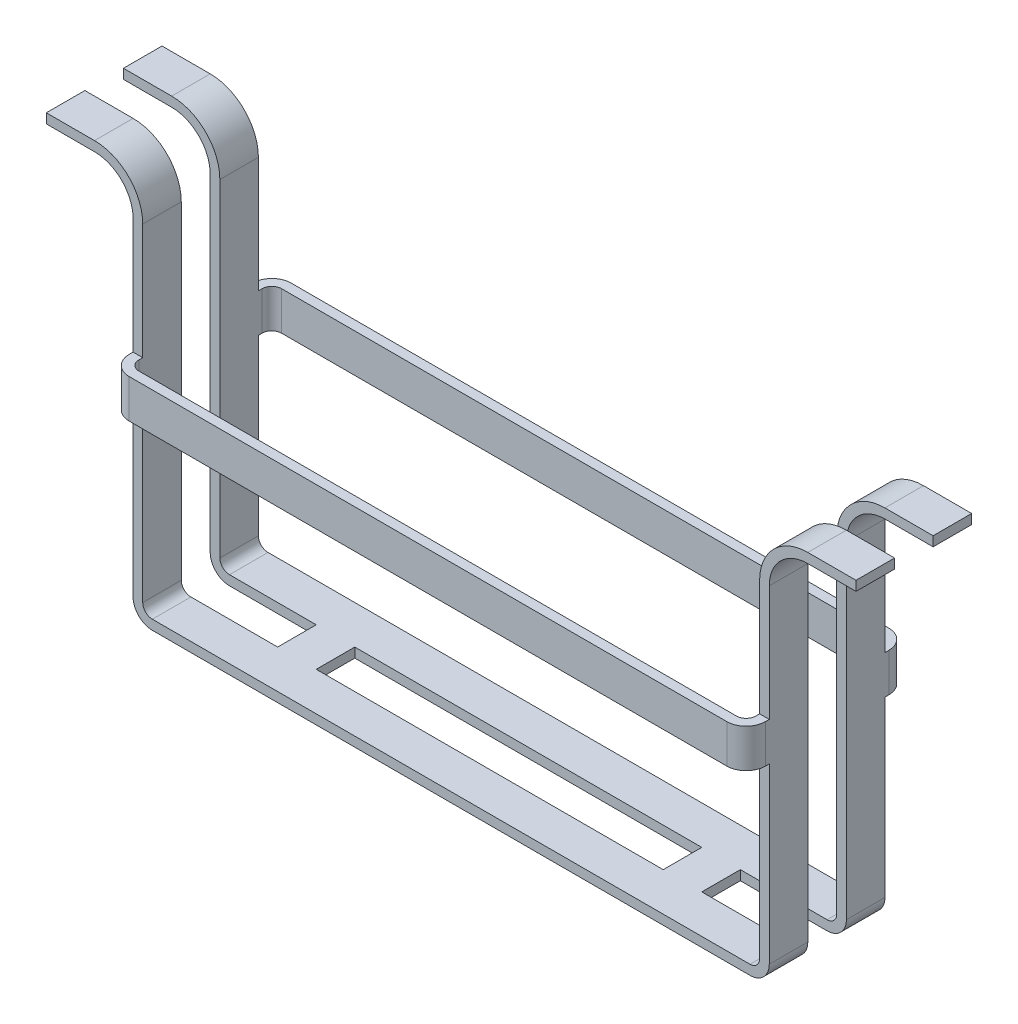
from build123d import *

# Parameters (mm, degrees)
EXTRUDE_1_DEPTH   = 20
EXTRUDE_2_DEPTH   = 20
SKETCH_3_W        = 20
SKETCH_3_H        = 20
EXTRUDE_1_2_DEPTH = 5


with BuildPart() as part:
    # 草图1 → Extrude 1 (new body)
    with BuildSketch(Plane.XY):
        with BuildLine():
            Line((210, 200), (185, 200))
            ThreePointArc((185, 200), (170.857864376, 194.142135624), (165, 180))
            Line((165, 180), (165, 10))
            ThreePointArc((165, 10), (162.071067812, 2.928932188), (155, 0))
            Line((155, 0), (-155, 0))
            ThreePointArc((-155, 0), (-162.071067812, 2.928932188), (-165, 10))
            Line((-165, 10), (-165, 180))
            ThreePointArc((-165, 180), (-170.857864376, 194.142135624), (-185, 200))
            Line((-185, 200), (-210, 200))
            Line((-210, 200), (-210, 205))
            Line((-210, 205), (-185, 205))
            ThreePointArc((-185, 205), (-167.32233047, 197.67766953), (-160, 180))
            Line((-160, 180), (-160, 10))
            ThreePointArc((-160, 10), (-158.535533906, 6.464466094), (-155, 5))
            Line((-155, 5), (155, 5))
            ThreePointArc((155, 5), (158.535533906, 6.464466094), (160, 10))
            Line((160, 10), (160, 180))
            ThreePointArc((160, 180), (167.32233047, 197.67766953), (185, 205))
            Line((185, 205), (210, 205))
            Line((210, 205), (210, 200))
        make_face()
    extrude(amount=EXTRUDE_1_DEPTH)

    # 草图2 → 拉伸-薄壁2 (add)
    with BuildSketch(Plane(origin=(0, 100, 0), x_dir=(1, 0, 0), z_dir=(0, 1, 0))):
        with BuildLine():
            Line((-165, -20), (-165, -22))
            ThreePointArc((-165, -22), (-162.071067812, -29.071067812), (-155, -32))
            Line((-155, -32), (155, -32))
            ThreePointArc((155, -32), (162.071067812, -29.071067812), (165, -22))
            Line((165, -22), (165, -20))
            Line((165, -20), (160, -20))
            Line((160, -20), (160, -22))
            ThreePointArc((160, -22), (158.535533906, -25.535533906), (155, -27))
            Line((155, -27), (-155, -27))
            ThreePointArc((-155, -27), (-158.535533906, -25.535533906), (-160, -22))
            Line((-160, -22), (-160, -20))
            Line((-160, -20), (-165, -20))
        make_face()
    extrude(amount=EXTRUDE_2_DEPTH)


with BuildPart() as body_2:
    # 镜向3: mirrored copy
    add(part.part.mirror(Plane.XY.offset(-10)))


with BuildPart() as part_1:
    add(part.part)

    add(body_2.part)  # Extrude 1 2 merges body 2
    # 草图3 → Extrude 1 2 (add)
    with BuildSketch(Plane(origin=(0, 5, 0), x_dir=(1, 0, 0), z_dir=(0, 1, 0))):
        with Locations((-100, 10)):
            Rectangle(SKETCH_3_W, SKETCH_3_H)
    extrude_1_2 = extrude(amount=-EXTRUDE_1_2_DEPTH)

    # 镜向4: Extrude 1 2 across plane
    add(extrude_1_2.mirror(Plane(origin=(0, 0, 0), x_dir=(0, 0, 1), z_dir=(1, 0, 0))))


solid = part_1.part
